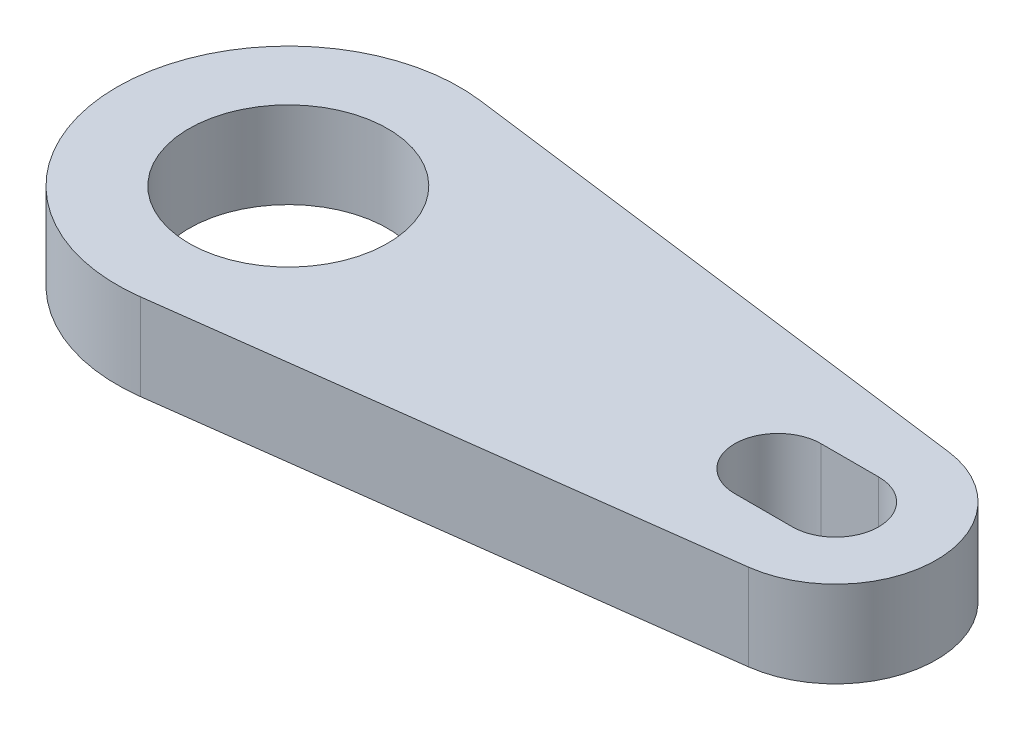
from build123d import *

# Parameters (mm, degrees)
SKETCH1_R           = 3.45
BOSS_EXTRUDE1_DEPTH = 1.5


with BuildPart() as part:
    # Sketch1 → Boss-Extrude1 (new, symmetric)
    with BuildSketch(Plane(origin=(0, 0, 0), x_dir=(1, 0, 0), z_dir=(0, 1, 0))):
        with BuildLine():
            Line((19.451315789, 3.470780036), (0.767236842, 5.900326061))
            ThreePointArc((0.767236842, 5.900326061), (-5.95, 0), (0.767236842, -5.900326061))
            Line((0.767236842, -5.900326061), (19.451315789, -3.470780036))
            ThreePointArc((19.451315789, -3.470780036), (22.5, 0), (19.451315789, 3.470780036))
        make_face()
        with Locations(Location((0, 0, 0), (0, 0, 270))):
            Circle(SKETCH1_R, mode=Mode.SUBTRACT)
        with BuildLine():
            Line((19, -1.5), (17, -1.5))
            ThreePointArc((17, -1.5), (15.5, 0), (17, 1.5))
            Line((17, 1.5), (19, 1.5))
            ThreePointArc((19, 1.5), (20.5, 0), (19, -1.5))
        make_face(mode=Mode.SUBTRACT)
    extrude(amount=BOSS_EXTRUDE1_DEPTH, both=True)


solid = part.part
